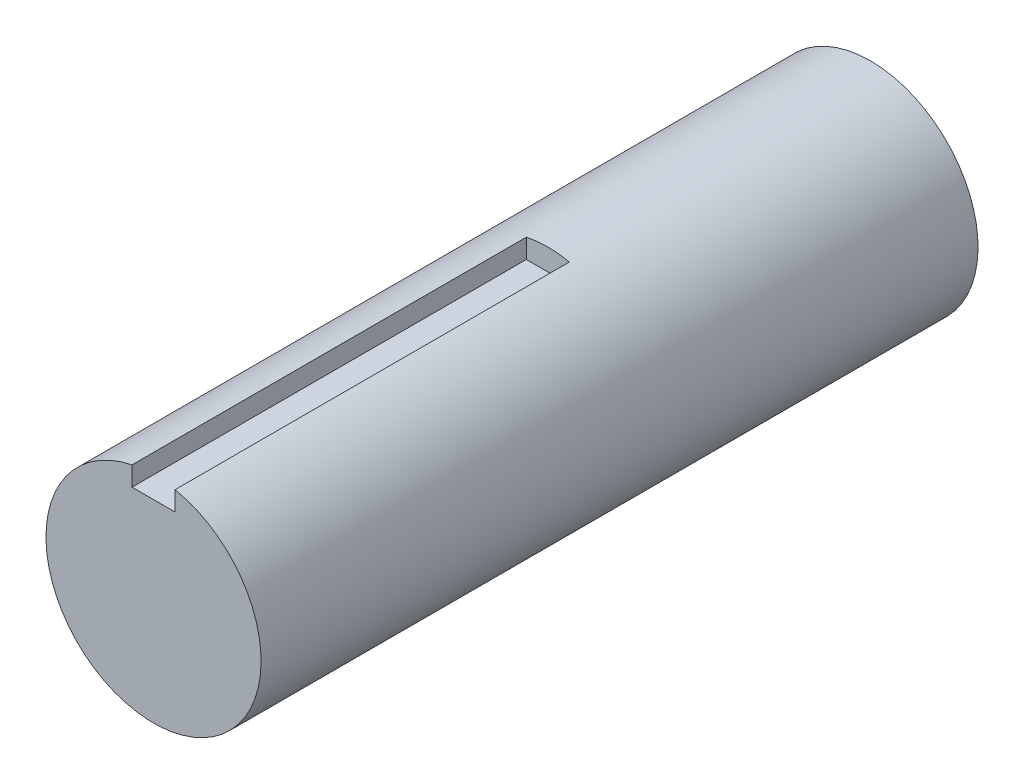
from build123d import *

# Parameters (mm, degrees)
SKETCH1_W          = 100
SKETCH1_H          = 15
SKETCH2_W          = 6
SKETCH2_H          = 6
CUT_EXTRUDE1_DEPTH = 55


with BuildPart() as part:
    # Sketch1 → Revolve1 (revolve)
    with BuildSketch(Plane(origin=(0, 0, 0), x_dir=(0, 0, -1), z_dir=(1, 0, 0))):
        Rectangle(SKETCH1_W, SKETCH1_H)
    revolve(axis=Axis((0, -7.5, -50), (0, 0, 1)))

    # Sketch2 → Cut-Extrude1 (cut)
    with BuildSketch(Plane.XY.offset(50)):
        with Locations((0, 7.5)):
            Rectangle(SKETCH2_W, SKETCH2_H)
    extrude(amount=-CUT_EXTRUDE1_DEPTH, mode=Mode.SUBTRACT)


solid = part.part
